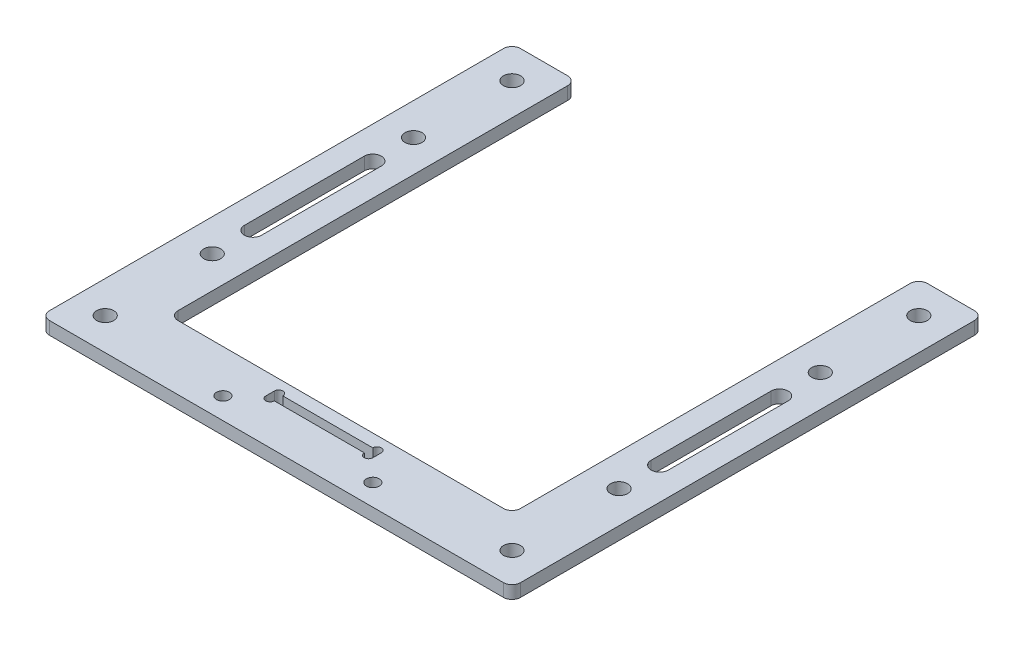
from build123d import *

# Parameters (mm, degrees)
SKETCH_1_R          = 2
SKETCH_1_R_2        = 1.5
SKETCH_1_W          = 25
SKETCH_1_H          = 2
EXTRUDE_1_DEPTH     = 3
CUT_EXTRUDE_1_DEPTH = 124.020323524
CUT_EXTRUDE_2_DEPTH = 124.020323524
FILLET_1_R          = 2


with BuildPart() as part:
    # 草图1 → 凸台-拉伸1 (new body)
    with BuildSketch(Plane(origin=(0, 0, 0), x_dir=(1, 0, 0), z_dir=(0, 1, 0))):
        Polygon((55, 110), (55, 0), (-55, 0), (-55, 110), (-40, 110), (-40, 15), (40, 15), (40, 110), align=None)
        with Locations(Location((47.5, 32.5, 0), (0, 0, 270))):
            Circle(SKETCH_1_R, mode=Mode.SUBTRACT)
        with Locations(Location((47.5, 7.5, 0), (0, 0, 270))):
            Circle(SKETCH_1_R, mode=Mode.SUBTRACT)
        with Locations(Location((47.5, 79.5, 0), (0, 0, 270))):
            Circle(SKETCH_1_R, mode=Mode.SUBTRACT)
        with Locations(Location((47.5, 102.5, 0), (0, 0, 270))):
            Circle(SKETCH_1_R, mode=Mode.SUBTRACT)
        with Locations(Location((-47.5, 102.5, 0), (0, 0, 90))):
            Circle(SKETCH_1_R, mode=Mode.SUBTRACT)
        with Locations(Location((-47.5, 79.5, 0), (0, 0, 90))):
            Circle(SKETCH_1_R, mode=Mode.SUBTRACT)
        with Locations(Location((-47.5, 7.5, 0), (0, 0, 90))):
            Circle(SKETCH_1_R, mode=Mode.SUBTRACT)
        with Locations(Location((-47.5, 32.5, 0), (0, 0, 90))):
            Circle(SKETCH_1_R, mode=Mode.SUBTRACT)
        with Locations(Location((17.5, 5, 0), (0, 0, 270))):
            Circle(SKETCH_1_R_2, mode=Mode.SUBTRACT)
        with Locations(Location((-17.5, 5, 0), (0, 0, 90))):
            Circle(SKETCH_1_R_2, mode=Mode.SUBTRACT)
        with Locations((0, 11)):
            Rectangle(SKETCH_1_W, SKETCH_1_H, mode=Mode.SUBTRACT)
    extrude(amount=EXTRUDE_1_DEPTH)

    # 草图2 → 切除-拉伸1 (cut, through all)
    with BuildSketch(Plane(origin=(0, 3, 0), x_dir=(1, 0, 0), z_dir=(0, 1, 0))):
        with BuildLine():
            Line((-12.5, 10), (-10.5, 10))
            ThreePointArc((-10.5, 10), (-11.5, 9), (-12.5, 10))
        make_face()
        with BuildLine():
            Line((12.5, 12), (10.5, 12))
            ThreePointArc((10.5, 12), (11.5, 13), (12.5, 12))
        make_face()
        with BuildLine():
            Line((-10.5, 12), (-12.5, 12))
            ThreePointArc((-12.5, 12), (-11.5, 13), (-10.5, 12))
        make_face()
        with BuildLine():
            Line((10.5, 10), (12.5, 10))
            ThreePointArc((12.5, 10), (11.5, 9), (10.5, 10))
        make_face()
    extrude(amount=-CUT_EXTRUDE_1_DEPTH, mode=Mode.SUBTRACT)

    # 草图3 → 切除-拉伸2 (cut, through all)
    with BuildSketch(Plane(origin=(0, 3, 0), x_dir=(1, 0, 0), z_dir=(0, 1, 0))):
        with BuildLine():
            Line((-45.5, 70), (-45.5, 42))
            ThreePointArc((-45.5, 42), (-47.5, 40), (-49.5, 42))
            Line((-49.5, 42), (-49.5, 70))
            ThreePointArc((-49.5, 70), (-47.5, 72), (-45.5, 70))
        make_face()
        with BuildLine():
            Line((45.5, 70), (45.5, 42))
            ThreePointArc((45.5, 42), (47.5, 40), (49.5, 42))
            Line((49.5, 42), (49.5, 70))
            ThreePointArc((49.5, 70), (47.5, 72), (45.5, 70))
        make_face()
    extrude(amount=-CUT_EXTRUDE_2_DEPTH, mode=Mode.SUBTRACT)

    # 圆角1
    fillet_1_edges = [part.edges().sort_by_distance(p)[0] for p in [
        (55, 1.5, -110),
        (55, 1.5, 0),
        (-55, 1.5, 0),
        (-55, 1.5, -110),
        (-40, 1.5, -110),
        (-40, 1.5, -15),
        (40, 1.5, -15),
        (40, 1.5, -110),
    ]]
    fillet(fillet_1_edges, radius=FILLET_1_R)


solid = part.part
